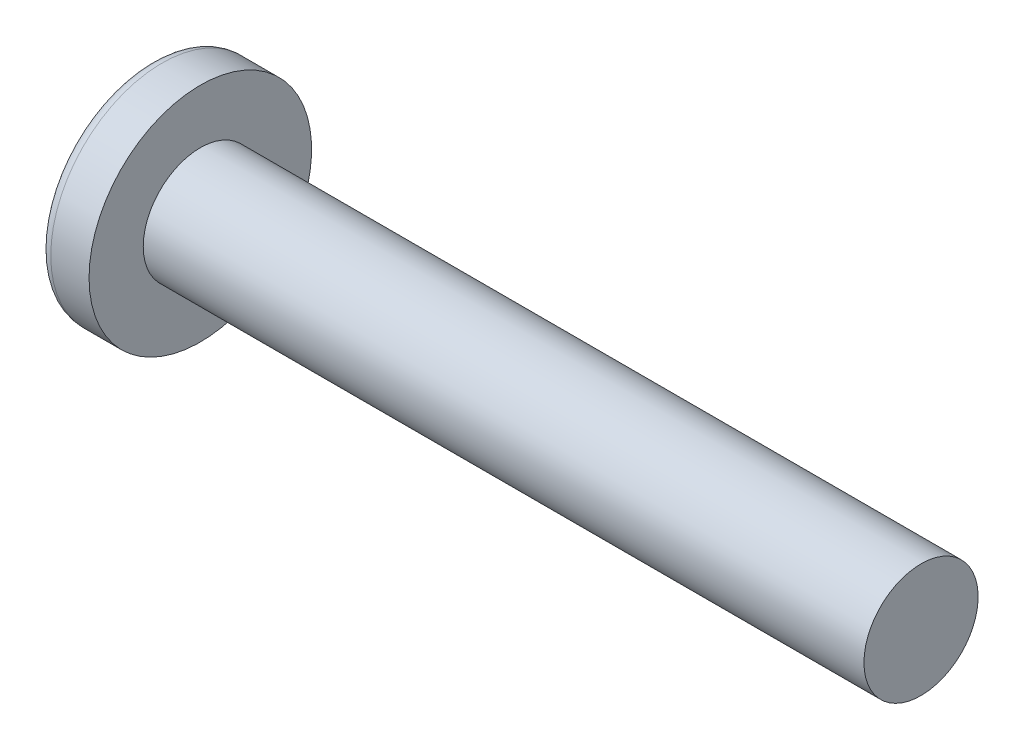
from build123d import *

# Parameters (mm, degrees)
CIRPATTERN1_COUNT = 2
CIRPATTERN1_ANGLE = 90


with BuildPart() as part:
    # BodySke → Base-Revolve (revolve)
    with BuildSketch(Plane.XY, mode=Mode.PRIVATE) as base_revolve_sk:
        with BuildLine():
            Line((1.8034, 1.2573), (1.8034, 2.4511))
            Line((1.8034, 2.4511), (0.960546522, 2.4511))
            ThreePointArc((0.960546522, 2.4511), (0.844549433, 2.423066093), (0.754157474, 2.345152561))
            ThreePointArc((0.754157474, 2.345152561), (0.193176952, 1.231715676), (0, 0))
            Line((0, 0), (17.6784, 0))
            Line((17.6784, 0), (17.6784, 1.2573))
            Line((17.6784, 1.2573), (1.8034, 1.2573))
        make_face()
    revolve(base_revolve_sk.sketch.rotate(Axis((-25.4, 0, 0), (1, 0, 0)), 90), axis=Axis((-25.4, 0, 0), (1, 0, 0)))

    # Sketch3 → Cut-Loft1 section 0
    with BuildSketch(Plane(origin=(0, 0, 0), x_dir=(0, 0, -1), z_dir=(1, 0, 0))):
        with BuildLine():
            Line((0.3683, -1.5875), (-0.3683, -1.5875))
            Line((-0.3683, -1.5875), (-0.3683, 1.5875))
            Line((-0.3683, 1.5875), (0.3683, 1.5875))
            Line((0.3683, 1.5875), (0.3683, -1.5875))
        make_face()
    # Sketch4 → Cut-Loft1 section 1
    with BuildSketch(Plane(origin=(1.7526, 0, 0), x_dir=(0, 0, -1), z_dir=(1, 0, 0))):
        with BuildLine():
            Line((0.18415, -0.18415), (-0.18415, -0.18415))
            Line((-0.18415, -0.18415), (-0.18415, 0.18415))
            Line((-0.18415, 0.18415), (0.18415, 0.18415))
            Line((0.18415, 0.18415), (0.18415, -0.18415))
        make_face()
    cut_loft1 = loft(mode=Mode.SUBTRACT)

    # CirPattern1: Cut-Loft1 ×2 about axis
    cirpattern1_axis = Axis((0, 0, 0), (1, 0, 0))
    for i in range(1, CIRPATTERN1_COUNT):
        add(cut_loft1.rotate(cirpattern1_axis, i * CIRPATTERN1_ANGLE / (CIRPATTERN1_COUNT - 1)), mode=Mode.SUBTRACT)


solid = part.part
